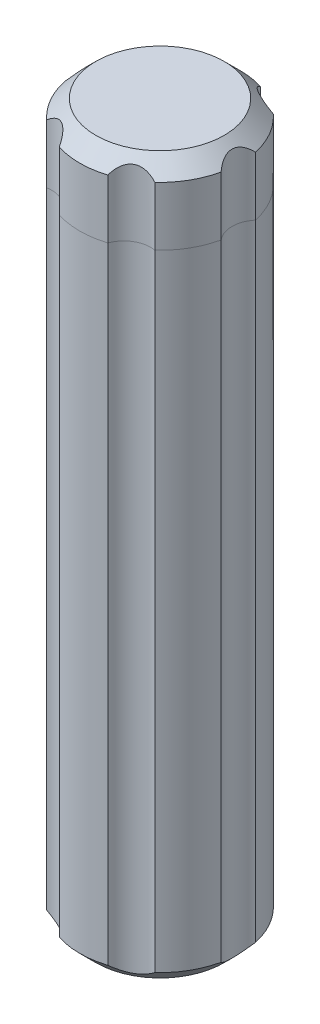
from build123d import *

# Parameters (mm, degrees)
SKETCH1_R           = 7.5
BOSS_EXTRUDE1_DEPTH = 60
SKETCH2_R           = 6.1
CUT_EXTRUDE1_DEPTH  = 58
SKETCH3_R           = 3.5
CUT_EXTRUDE2_DEPTH  = 61.930288035
SKETCH4_R           = 7.5
BOSS_EXTRUDE2_DEPTH = 7
CUT_EXTRUDE3_DEPTH  = 4
CHAMFER1_SIZE       = 1.5
CHAMFER2_SIZE       = 1.5
CUT_EXTRUDE4_DEPTH  = 67


with BuildPart() as part:
    # Sketch1 → Boss-Extrude1 (new body)
    with BuildSketch(Plane(origin=(0, 0, 0), x_dir=(1, 0, 0), z_dir=(0, 1, 0))):
        with Locations(Location((0, 0, 0), (0, 0, 270))):
            Circle(SKETCH1_R)
    extrude(amount=BOSS_EXTRUDE1_DEPTH)

    # Sketch2 → Cut-Extrude1 (cut)
    with BuildSketch(Plane(origin=(0, 60, 0), x_dir=(1, 0, 0), z_dir=(0, 1, 0))):
        with Locations(Location((0, 0, 0), (0, 0, 270))):
            Circle(SKETCH2_R)
    extrude(amount=-CUT_EXTRUDE1_DEPTH, mode=Mode.SUBTRACT)

    # Sketch3 → Cut-Extrude2 (cut, through all)
    with BuildSketch(Plane.XY):
        with Locations((0, 32)):
            Circle(SKETCH3_R)
    extrude(amount=-CUT_EXTRUDE2_DEPTH, mode=Mode.SUBTRACT)

    # Chamfer1
    chamfer1_edges = [part.edges().sort_by_distance(p)[0] for p in [
        (0, 0, -7.5),
    ]]
    chamfer(chamfer1_edges, length=CHAMFER1_SIZE)


with BuildPart() as body_2:
    # Sketch4 → Boss-Extrude2 (new body)
    with BuildSketch(Plane(origin=(0, 60, 0), x_dir=(1, 0, 0), z_dir=(0, 1, 0))):
        with Locations(Location((0, 0, 0), (0, 0, 270))):
            Circle(SKETCH4_R)
    extrude(amount=BOSS_EXTRUDE2_DEPTH)

    # Sketch5 → Cut-Extrude3 (cut)
    with BuildSketch(Plane.XZ.offset(-60)):
        Polygon((2.915618859, 5.05), (-2.915618859, 5.05), (-5.831237719, 0), (-2.915618859, -5.05), (2.915618859, -5.05), (5.831237719, 0), align=None)
    extrude(amount=-CUT_EXTRUDE3_DEPTH, mode=Mode.SUBTRACT)

    # Chamfer2
    chamfer2_edges = [body_2.edges().sort_by_distance(p)[0] for p in [
        (0, 67, -7.5),
    ]]
    chamfer(chamfer2_edges, length=CHAMFER2_SIZE)


with BuildPart() as cut_extrude4_tool:
    # Sketch7 → Cut-Extrude4 (new body)
    with BuildSketch(Plane(origin=(0, 67, 0), x_dir=(1, 0, 0), z_dir=(0, 1, 0))):
        with BuildLine():
            ThreePointArc((-5.868802154, 5.834936491), (-3.368802154, 5.834936491), (-2.118802154, 8))
            Line((-2.118802154, 8), (-4.618802154, 8))
            Line((-4.618802154, 8), (-5.868802154, 5.834936491))
        make_face()
        with BuildLine():
            Line((-4.618802154, 8), (-2.118802154, 8))
            ThreePointArc((-2.118802154, 8), (-5.868802154, 10.165063509), (-5.868802154, 5.834936491))
            Line((-5.868802154, 5.834936491), (-4.618802154, 8))
        make_face()
        with BuildLine():
            ThreePointArc((-6.737604307, 0), (-7.072540798, 1.25), (-7.987604307, 2.165063509))
            Line((-7.987604307, 2.165063509), (-9.237604307, 0))
            Line((-9.237604307, 0), (-7.987604307, -2.165063509))
            ThreePointArc((-7.987604307, -2.165063509), (-7.072540798, -1.25), (-6.737604307, 0))
        make_face()
        with BuildLine():
            Line((-9.237604307, 0), (-7.987604307, 2.165063509))
            ThreePointArc((-7.987604307, 2.165063509), (-11.737604307, 0), (-7.987604307, -2.165063509))
            Line((-7.987604307, -2.165063509), (-9.237604307, 0))
        make_face()
        with BuildLine():
            ThreePointArc((-2.118802154, -8), (-3.368802154, -5.834936491), (-5.868802154, -5.834936491))
            Line((-5.868802154, -5.834936491), (-4.618802154, -8))
            Line((-4.618802154, -8), (-2.118802154, -8))
        make_face()
        with BuildLine():
            Line((-4.618802154, -8), (-5.868802154, -5.834936491))
            ThreePointArc((-5.868802154, -5.834936491), (-5.868802154, -10.165063509), (-2.118802154, -8))
            Line((-2.118802154, -8), (-4.618802154, -8))
        make_face()
        with BuildLine():
            ThreePointArc((7.118802154, -8), (6.783865663, -6.75), (5.868802154, -5.834936491))
            Line((5.868802154, -5.834936491), (4.618802154, -8))
            Line((4.618802154, -8), (2.118802154, -8))
            ThreePointArc((2.118802154, -8), (4.618802154, -10.5), (7.118802154, -8))
        make_face()
        with BuildLine():
            Line((4.618802154, -8), (5.868802154, -5.834936491))
            ThreePointArc((5.868802154, -5.834936491), (3.368802154, -5.834936491), (2.118802154, -8))
            Line((2.118802154, -8), (4.618802154, -8))
        make_face()
        with BuildLine():
            ThreePointArc((11.737604307, 0), (10.487604307, 2.165063509), (7.987604307, 2.165063509))
            Line((7.987604307, 2.165063509), (9.237604307, 0))
            Line((9.237604307, 0), (7.987604307, -2.165063509))
            ThreePointArc((7.987604307, -2.165063509), (10.487604307, -2.165063509), (11.737604307, 0))
        make_face()
        with BuildLine():
            Line((9.237604307, 0), (7.987604307, 2.165063509))
            ThreePointArc((7.987604307, 2.165063509), (6.737604307, 0), (7.987604307, -2.165063509))
            Line((7.987604307, -2.165063509), (9.237604307, 0))
        make_face()
        with BuildLine():
            ThreePointArc((7.118802154, 8), (4.618802154, 10.5), (2.118802154, 8))
            Line((2.118802154, 8), (4.618802154, 8))
            Line((4.618802154, 8), (5.868802154, 5.834936491))
            ThreePointArc((5.868802154, 5.834936491), (6.783865663, 6.75), (7.118802154, 8))
        make_face()
        with BuildLine():
            Line((4.618802154, 8), (2.118802154, 8))
            ThreePointArc((2.118802154, 8), (3.368802154, 5.834936491), (5.868802154, 5.834936491))
            Line((5.868802154, 5.834936491), (4.618802154, 8))
        make_face()
    extrude(amount=-CUT_EXTRUDE4_DEPTH)


with BuildPart() as part_1:
    add(part.part)

    # Cut-Extrude4: cut by cut_extrude4_tool
    add(cut_extrude4_tool.part, mode=Mode.SUBTRACT)


with BuildPart() as body_2_1:
    add(body_2.part)

    # Cut-Extrude4: cut by cut_extrude4_tool
    add(cut_extrude4_tool.part, mode=Mode.SUBTRACT)


solid = Compound([part_1.part, body_2_1.part])
